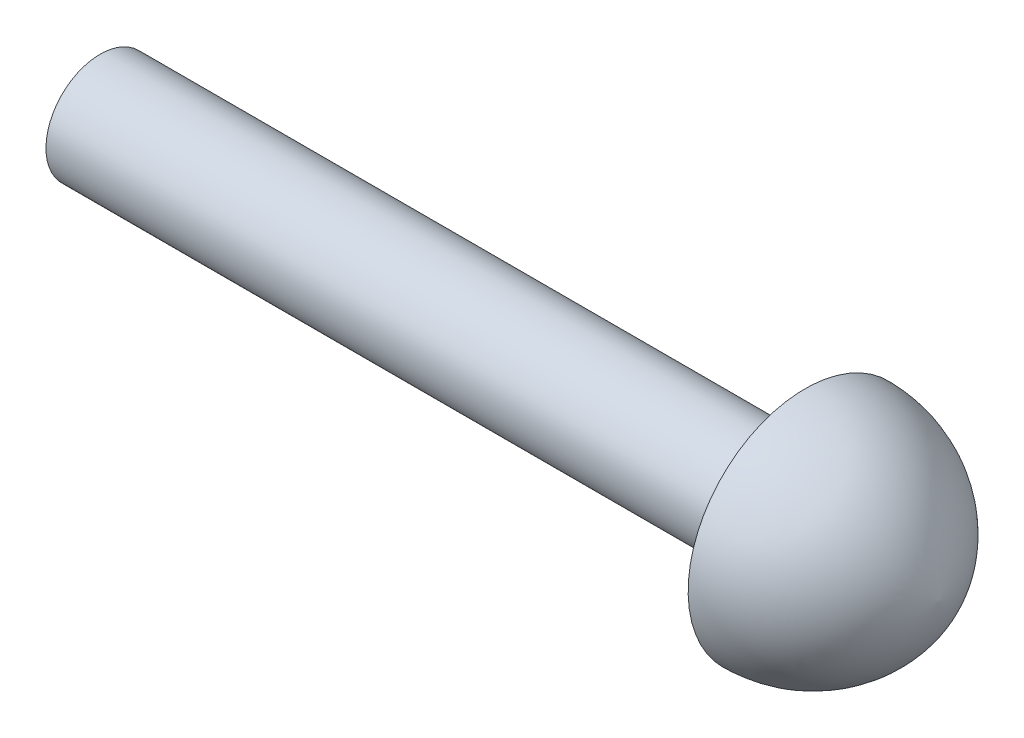
from build123d import *


with BuildPart() as part:
    # Sketch1 → Revolve1 (revolve)
    with BuildSketch(Plane.XY, mode=Mode.PRIVATE) as revolve1_sk:
        with BuildLine():
            Line((0, 0), (0, 2))
            Line((0, 2), (26, 2))
            Line((26, 2), (26, 4.311926606))
            ThreePointArc((26, 4.311926606), (29.283263089, 3.082892461), (30.952429202, 0))
            Line((30.952429202, 0), (0, 0))
        make_face()
    revolve(revolve1_sk.sketch.rotate(Axis((0, 0, 0), (1, 0, 0)), 180), axis=Axis((0, 0, 0), (1, 0, 0)))


solid = part.part
